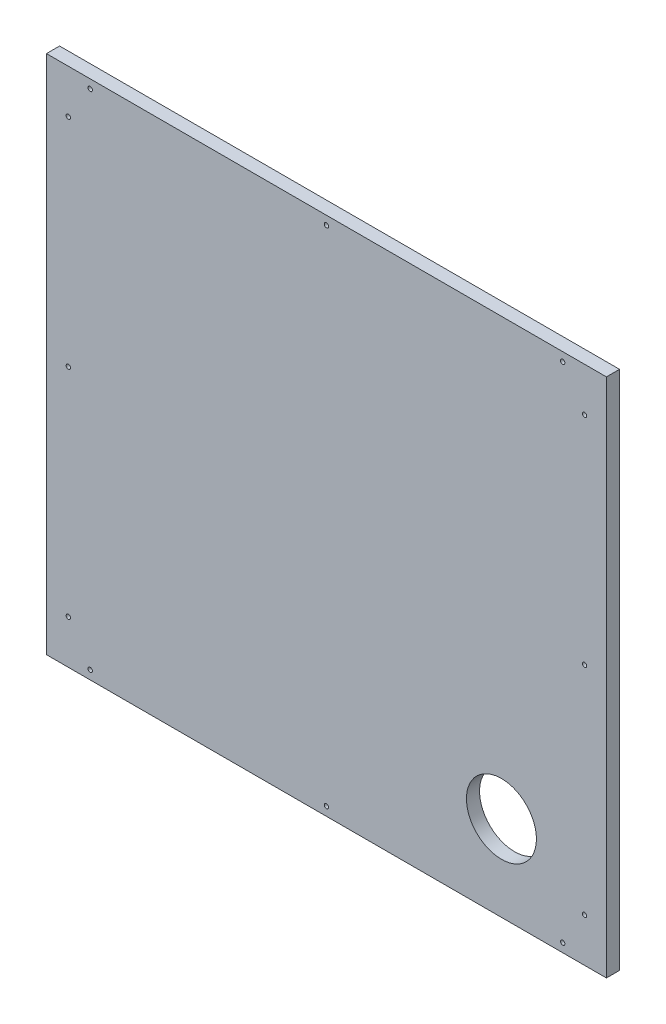
from build123d import *

# Parameters (mm, degrees)
SKETCH_1_W          = 640
SKETCH_1_H          = 595
EXTRUDE_1_DEPTH     = 15
SKETCH_2_R          = 2.5
CUT_EXTRUDE_1_DEPTH = 438.185601318
SKETCH_2_3_R        = 2.5
CUT_EXTRUDE_2_DEPTH = 438.185601318
SKETCH_3_R          = 40
CUT_EXTRUDE_3_DEPTH = 438.185601318


with BuildPart() as part:
    # ｽｹｯﾁ1 → ﾎﾞｽ - 押し出し1 (new body)
    with BuildSketch(Plane.XY):
        Rectangle(SKETCH_1_W, SKETCH_1_H)
    extrude(amount=EXTRUDE_1_DEPTH)

    # ｽｹｯﾁ2 → ｶｯﾄ - 押し出し1 (cut, through all)
    with BuildSketch(Plane.XY.offset(15)):
        with Locations((-270, 287.5)):
            Circle(SKETCH_2_R)
        with Locations((0, 287.5)):
            Circle(SKETCH_2_R)
        with Locations((270, 287.5)):
            Circle(SKETCH_2_R)
    cut_extrude_1 = extrude(amount=-CUT_EXTRUDE_1_DEPTH, mode=Mode.SUBTRACT)

    # ｽｹｯﾁ2<3> → ｶｯﾄ - 押し出し2 (cut, through all)
    with BuildSketch(Plane.XY.offset(15)):
        with Locations((-295, 247.5)):
            Circle(SKETCH_2_3_R)
        with Locations((-295, 0)):
            Circle(SKETCH_2_3_R)
        with Locations((-295, -247.5)):
            Circle(SKETCH_2_3_R)
    cut_extrude_2 = extrude(amount=-CUT_EXTRUDE_2_DEPTH, mode=Mode.SUBTRACT)

    # ﾐﾗｰ1: ｶｯﾄ - 押し出し1 across plane
    add(cut_extrude_1.mirror(Plane.ZX), mode=Mode.SUBTRACT)

    # ﾐﾗｰ2: ｶｯﾄ - 押し出し2 across plane
    add(cut_extrude_2.mirror(Plane(origin=(0, 0, 0), x_dir=(0, 0, 1), z_dir=(1, 0, 0))), mode=Mode.SUBTRACT)

    # ｽｹｯﾁ3 → ｶｯﾄ - 押し出し3 (cut, through all)
    with BuildSketch(Plane.XY.offset(15)):
        with Locations((200, -200)):
            Circle(SKETCH_3_R)
    extrude(amount=-CUT_EXTRUDE_3_DEPTH, mode=Mode.SUBTRACT)


solid = part.part
